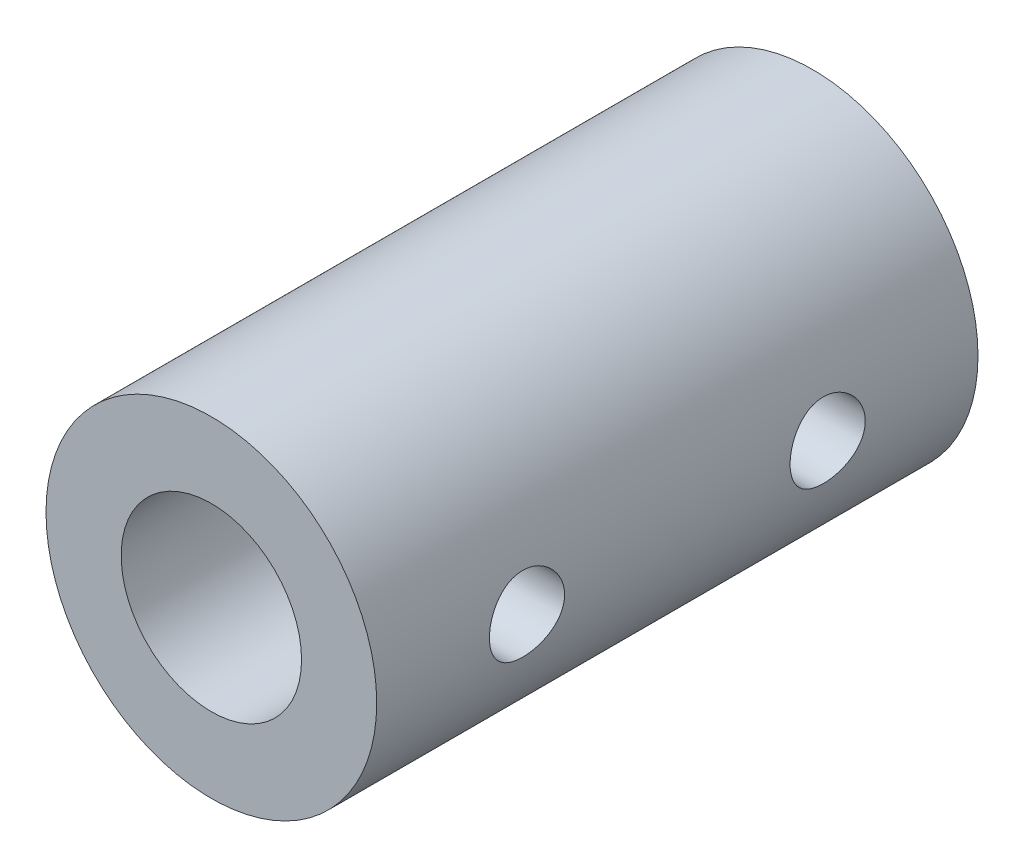
from build123d import *

# Parameters (mm, degrees)
CROQUIS1_R                                   = 5.5
CROQUIS1_R_2                                 = 3
SALIENTE_EXTRUIR1_DEPTH                      = 20
PERFORADOR_PARA_ROSCAR_PARA_MACHO_DE_2_COUNT = 2
PERFORADOR_PARA_ROSCAR_PARA_MACHO_DE_2_PITCH = 10


with BuildPart() as part:
    # Croquis1 → Saliente-Extruir1 (new body)
    with BuildSketch(Plane.XY):
        Circle(CROQUIS1_R)
        Circle(CROQUIS1_R_2, mode=Mode.SUBTRACT)
    extrude(amount=SALIENTE_EXTRUIR1_DEPTH)

    # Croquis4 → Perforador para roscar para macho de roscar para M31 (revolve, cut)
    with BuildSketch(Plane(origin=(0, 0, 5), x_dir=(0, 0, 1), z_dir=(0, 1, 0))):
        Polygon((0, 0), (0, 5.5), (1.25, 5.5), (1.25, 0.025), (1.275, 0), align=None)
    perforador_para_roscar_para_macho_de_ros = revolve(axis=Axis((-6.35, 0, 5), (1, 0, 0)), mode=Mode.SUBTRACT)

    # Perforador para roscar para macho de 2: Perforador para roscar para macho de roscar para M31 ×2
    with Locations(*[(0, 0, i * PERFORADOR_PARA_ROSCAR_PARA_MACHO_DE_2_PITCH) for i in range(1, PERFORADOR_PARA_ROSCAR_PARA_MACHO_DE_2_COUNT)]):
        add(perforador_para_roscar_para_macho_de_ros, mode=Mode.SUBTRACT)


solid = part.part
